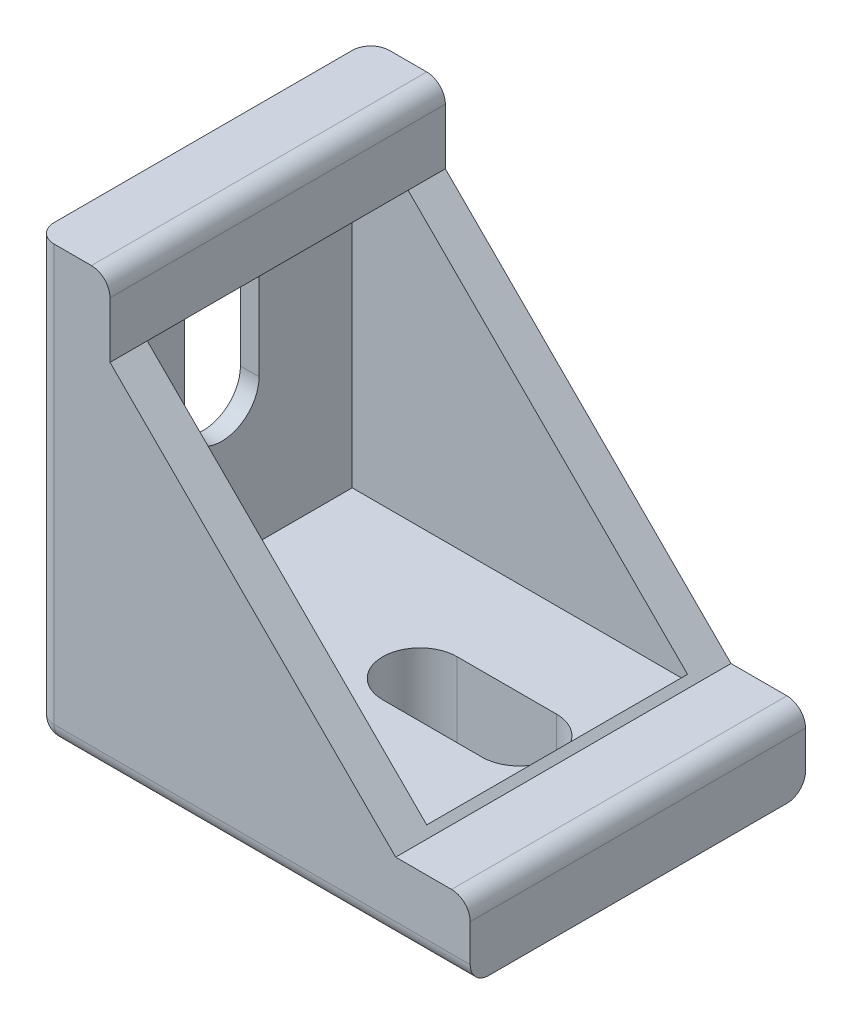
from build123d import *

# Parameters (mm, degrees)
EXTRUDE_1_DEPTH     = 27
FILLET_1_R          = 1.5
FILLET_2_R          = 1.5
CUT_EXTRUDE_1_DEPTH = 27
CUT_EXTRUDE_2_DEPTH = 27
SKETCH_5_W          = 21
SKETCH_5_H          = 23
CUT_EXTRUDE_3_DEPTH = 27


with BuildPart() as part:
    # 草图1 → 凸台-拉伸1 (new body)
    with BuildSketch(Plane.XY):
        Polygon((-11.5, 11.5), (11.5, -11.5), (17.5, -11.5), (17.5, -17.5), (-17.5, -17.5), (-17.5, 17.5), (-11.5, 17.5), align=None)
    extrude(amount=EXTRUDE_1_DEPTH)

    # 圆角1
    fillet_1_edges = [part.edges().sort_by_distance(p)[0] for p in [
        (-11.5, 17.5, 13.5),
        (17.5, -11.5, 13.5),
    ]]
    fillet(fillet_1_edges, radius=FILLET_1_R)

    # 圆角2
    fillet_2_edges = [part.edges().sort_by_distance(p)[0] for p in [
        (-17.5, -17.5, 13.5),
        (-17.5, 0, 27),
        (0, -17.5, 27),
        (0, -17.5, 0),
        (-17.5, 0, 0),
    ]]
    fillet(fillet_2_edges, radius=FILLET_2_R)

    # 草图2 → 切除-拉伸1 (cut)
    with BuildSketch(Plane.XZ.offset(17.5)):
        with BuildLine():
            Line((0, 16.550659992), (8, 16.550659992))
            ThreePointArc((8, 16.550659992), (11, 13.550659992), (8, 10.550659992))
            Line((8, 10.550659992), (0, 10.550659992))
            ThreePointArc((0, 10.550659992), (-3, 13.550659992), (0, 16.550659992))
        make_face()
    extrude(amount=-CUT_EXTRUDE_1_DEPTH, mode=Mode.SUBTRACT)

    # 草图3 → 切除-拉伸2 (cut)
    with BuildSketch(Plane.ZY.offset(17.5)):
        with BuildLine():
            Line((10.5, 0), (10.5, 8))
            ThreePointArc((10.5, 8), (13.5, 11), (16.5, 8))
            Line((16.5, 8), (16.5, 0))
            ThreePointArc((16.5, 0), (13.5, -3), (10.5, 0))
        make_face()
    extrude(amount=-CUT_EXTRUDE_2_DEPTH, mode=Mode.SUBTRACT)

    # 草图5 → 切除-拉伸3 (cut)
    with BuildSketch(Plane(origin=(11, 0, 0), x_dir=(0, 0, -1), z_dir=(1, 0, 0))):
        with Locations((-13.5, 0)):
            Rectangle(SKETCH_5_W, SKETCH_5_H)
    extrude(amount=-CUT_EXTRUDE_3_DEPTH, mode=Mode.SUBTRACT)


solid = part.part
